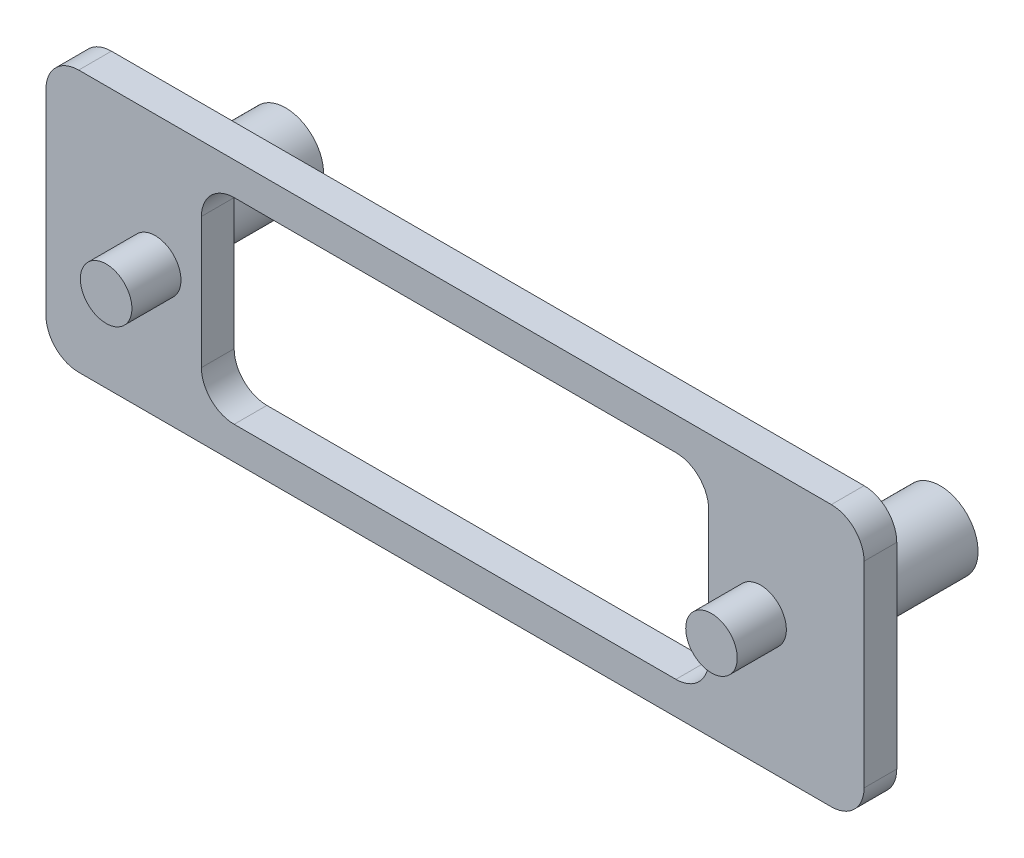
from build123d import *

# Parameters (mm, degrees)
SKETCH1_W           = 50
SKETCH1_H           = 16
BOSS_EXTRUDE1_DEPTH = 2
SKETCH2_R           = 1.575
BOSS_EXTRUDE2_DEPTH = 3
SKETCH3_W           = 31
SKETCH3_H           = 12
CUT_EXTRUDE1_DEPTH  = 3
FILLET1_R           = 2
FILLET2_R           = 2
SKETCH4_R           = 2.325
BOSS_EXTRUDE3_DEPTH = 8


with BuildPart() as part:
    # Sketch1 → Boss-Extrude1 (new body)
    with BuildSketch(Plane.XY):
        with Locations((25, 8)):
            Rectangle(SKETCH1_W, SKETCH1_H)
    extrude(amount=BOSS_EXTRUDE1_DEPTH)

    # Sketch2 → Boss-Extrude2 (add)
    with BuildSketch(Plane.XY.offset(2)):
        with Locations(Location((6.675, 8, 0), (0, 0, 180))):
            Circle(SKETCH2_R)
        with Locations(Location((43.675, 8, 0), (0, 0, 180))):
            Circle(SKETCH2_R)
    extrude(amount=BOSS_EXTRUDE2_DEPTH)

    # Sketch3 → Cut-Extrude1 (cut)
    with BuildSketch(Plane.XY.offset(2)):
        with Locations((25, 8)):
            Rectangle(SKETCH3_W, SKETCH3_H)
    extrude(amount=-CUT_EXTRUDE1_DEPTH, mode=Mode.SUBTRACT)

    # Fillet1
    fillet1_edges = [part.edges().sort_by_distance(p)[0] for p in [
        (9.5, 2, 1),
        (9.5, 14, 1),
        (40.5, 14, 1),
        (40.5, 2, 1),
    ]]
    fillet(fillet1_edges, radius=FILLET1_R)

    # Fillet2
    fillet2_edges = [part.edges().sort_by_distance(p)[0] for p in [
        (0, 16, 1),
        (50, 16, 1),
        (50, 0, 1),
        (0, 0, 1),
    ]]
    fillet(fillet2_edges, radius=FILLET2_R)

    # Sketch4 → Boss-Extrude3 (add)
    with BuildSketch(Plane(origin=(0, 0, 0), x_dir=(-1, 0, 0), z_dir=(0, 0, -1))):
        with Locations((-44.643589023, 8)):
            Circle(SKETCH4_R)
        with Locations((-4.643589023, 8)):
            Circle(SKETCH4_R)
    extrude(amount=BOSS_EXTRUDE3_DEPTH)


solid = part.part
